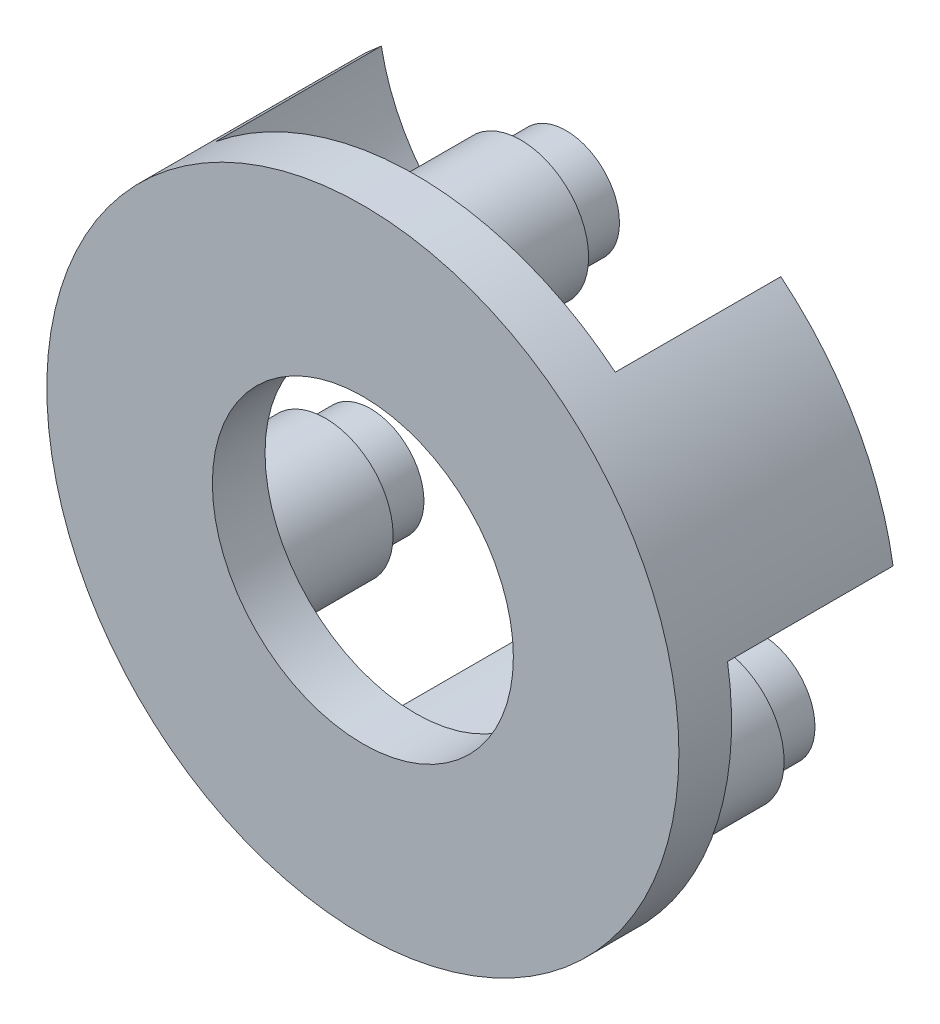
from build123d import *
from build123d.topology import SkipClean

# Parameters (mm, degrees)
SKETCH1_R           = 21
BOSS_EXTRUDE1_DEPTH = 3.5
SKETCH4_R           = 10
CUT_EXTRUDE1_DEPTH  = 8.2
SKETCH11_R          = 1.5
CUT_EXTRUDE2_DEPTH  = 10
BOSS_EXTRUDE2_START = 11
BOSS_EXTRUDE2_DEPTH = 11
SKETCH14_R          = 1.5
CUT_EXTRUDE3_DEPTH  = 5
SKETCH16_R          = 3.55
BOSS_EXTRUDE3_DEPTH = 13.5
SKETCH17_R          = 4.5
BOSS_EXTRUDE4_DEPTH = 7


with BuildPart() as part:
    # Sketch1 → Boss-Extrude1 (new body)
    with BuildSketch(Plane.XY):
        Circle(SKETCH1_R)
    extrude(amount=BOSS_EXTRUDE1_DEPTH)

    # Sketch4 → Cut-Extrude1 (cut)
    with BuildSketch(Plane(origin=(0, 0, 0), x_dir=(-1, 0, 0), z_dir=(0, 0, -1))):
        Circle(SKETCH4_R)
    extrude(amount=-CUT_EXTRUDE1_DEPTH, mode=Mode.SUBTRACT)

    # Sketch11 → Cut-Extrude2 (cut)
    with BuildSketch(Plane(origin=(0, 0, 0), x_dir=(-1, 0, 0), z_dir=(0, 0, -1))):
        with Locations((0, 15)):
            Circle(SKETCH11_R)
        with Locations((12.990381057, -7.5)):
            Circle(SKETCH11_R)
        with Locations((-12.990381057, -7.5)):
            Circle(SKETCH11_R)
    extrude(amount=-CUT_EXTRUDE2_DEPTH, mode=Mode.SUBTRACT)

    # Sketch3 → Boss-Extrude2 (add)
    with SkipClean():  # the faces are left unmerged after this step: merging them gives an invalid solid
        with BuildSketch(Plane(origin=(0, 0, 0), x_dir=(-1, 0, 0), z_dir=(0, 0, -1)).offset(BOSS_EXTRUDE2_START)):
            with BuildLine():
                ThreePointArc((-3.021915591, -12.129221993), (-4.618435811, -16.247865366), (-7.4589705, -19.630684121))
                ThreePointArc((-7.4589705, -19.630684121), (0, -21), (7.4589705, -19.630684121))
                ThreePointArc((7.4589705, -19.630684121), (4.618435811, -16.247865366), (3.021915591, -12.129221993))
                ThreePointArc((3.021915591, -12.129221993), (0, -12.5), (-3.021915591, -12.129221993))
            make_face()
            with BuildLine():
                ThreePointArc((-20.730156393, 3.355684121), (-16.38028207, 4.124249945), (-12.01517217, 3.447555327))
                ThreePointArc((-12.01517217, 3.447555327), (-10.825317547, 6.25), (-8.993256579, 8.681666667))
                ThreePointArc((-8.993256579, 8.681666667), (-11.761846259, 12.123615422), (-13.271185893, 16.275))
                ThreePointArc((-13.271185893, 16.275), (-18.186533479, 10.5), (-20.730156393, 3.355684121))
            make_face()
            with BuildLine():
                ThreePointArc((8.993256579, 8.681666667), (10.825317547, 6.25), (12.01517217, 3.447555327))
                ThreePointArc((12.01517217, 3.447555327), (16.38028207, 4.124249945), (20.730156393, 3.355684121))
                ThreePointArc((20.730156393, 3.355684121), (18.186533479, 10.5), (13.271185893, 16.275))
                ThreePointArc((13.271185893, 16.275), (11.761846259, 12.123615422), (8.993256579, 8.681666667))
            make_face()
        extrude(amount=-BOSS_EXTRUDE2_DEPTH)

    # Sketch14 → Cut-Extrude3 (cut)
    with SkipClean():  # the faces are left unmerged after this step: merging them gives an invalid solid
        with BuildSketch(Plane(origin=(0, 0, -11), x_dir=(-1, 0, 0), z_dir=(0, 0, -1))):
            with Locations((13.856406461, 8)):
                Circle(SKETCH14_R)
            with Locations((0, -16)):
                Circle(SKETCH14_R)
            with Locations((-13.856406461, 8)):
                Circle(SKETCH14_R)
        extrude(amount=-CUT_EXTRUDE3_DEPTH, mode=Mode.SUBTRACT)

    # Sketch16 → Boss-Extrude3 (add)
    with SkipClean():  # the faces are left unmerged after this step: merging them gives an invalid solid
        with BuildSketch(Plane.XY.offset(3.5)):
            with Locations((0, 15)):
                Circle(SKETCH16_R)
            with Locations((12.990381057, -7.5)):
                Circle(SKETCH16_R)
            with Locations((-12.990381057, -7.5)):
                Circle(SKETCH16_R)
        extrude(amount=-BOSS_EXTRUDE3_DEPTH)

    # Sketch17 → Boss-Extrude4 (add)
    with SkipClean():  # the faces are left unmerged after this step: merging them gives an invalid solid
        with BuildSketch(Plane(origin=(0, 0, 0), x_dir=(-1, 0, 0), z_dir=(0, 0, -1))):
            with Locations(Location((0, 15, 0), (0, 0, 180))):
                Circle(SKETCH17_R)
            with Locations(Location((12.990381057, -7.5, 0), (0, 0, 180))):
                Circle(SKETCH17_R)
            with Locations(Location((-12.990381057, -7.5, 0), (0, 0, 180))):
                Circle(SKETCH17_R)
        extrude(amount=BOSS_EXTRUDE4_DEPTH)


solid = part.part
